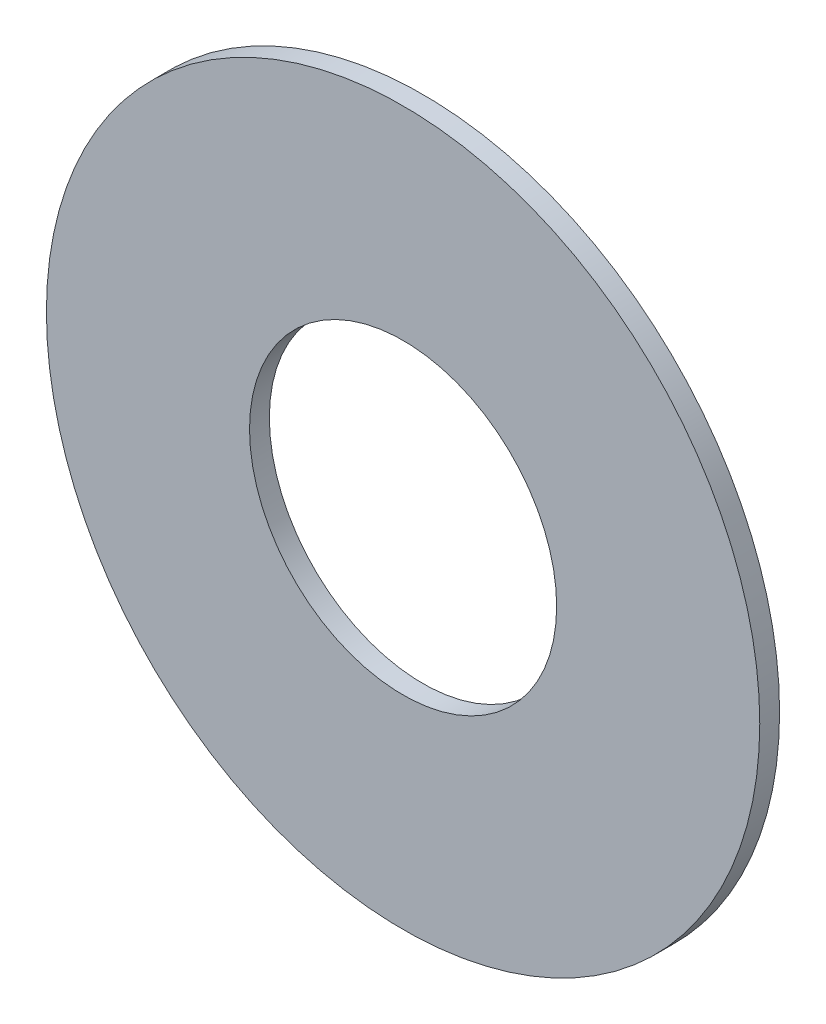
from build123d import *

# Parameters (mm, degrees)
SKETCH1_R           = 36
SKETCH1_R_2         = 15.5
BOSS_EXTRUDE1_DEPTH = 2


with BuildPart() as part:
    # Sketch1 → Boss-Extrude1 (new body)
    with BuildSketch(Plane.XY):
        with Locations((-0.707224335, 0)):
            Circle(SKETCH1_R)
        with Locations((-0.707224335, 0)):
            Circle(SKETCH1_R_2, mode=Mode.SUBTRACT)
    extrude(amount=BOSS_EXTRUDE1_DEPTH)


solid = part.part
